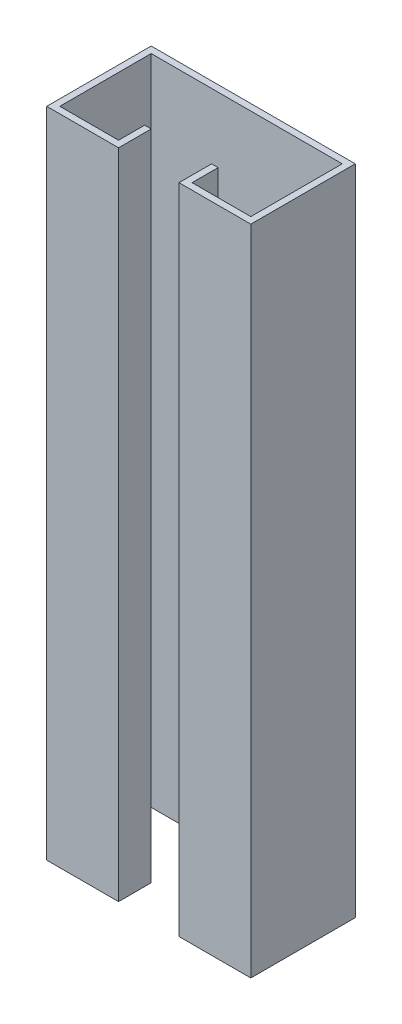
from build123d import *

# Parameters (mm, degrees)
BOSS_EXTRUDE1_DEPTH = 1270


with BuildPart() as part:
    # Sketch1 → Boss-Extrude1 (new body)
    with BuildSketch(Plane(origin=(0, 0, 0), x_dir=(1, 0, 0), z_dir=(0, 1, 0))):
        Polygon((58.783953118, -12.7), (58.783953118, 50.8), (71.483953118, 50.8), (71.483953118, 0), (185.783953118, 0), (185.783953118, 177.8), (-185.783953118, 177.8), (-185.783953118, 0), (-71.483953118, 0), (-71.483953118, 50.8), (-58.783953118, 50.8), (-58.783953118, -12.7), (-198.483953118, -12.7), (-198.483953118, 190.5), (198.483953118, 190.5), (198.483953118, -12.7), align=None)
    extrude(amount=BOSS_EXTRUDE1_DEPTH)


solid = part.part
